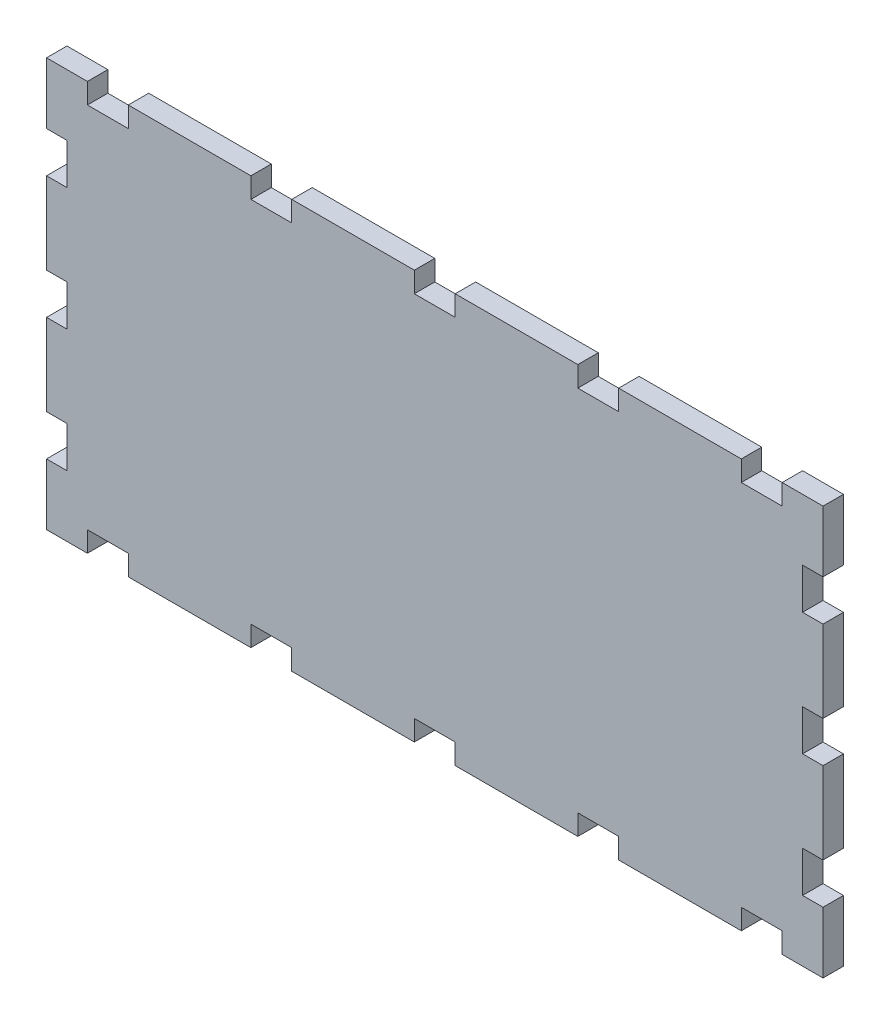
from build123d import *

# Parameters (mm, degrees)
BOSS_EXTRUDE1_DEPTH = 5


with BuildPart() as part:
    # Sketch1 → Boss-Extrude1 (new body)
    with BuildSketch(Plane.XY):
        Polygon((-85, 45), (-85, 50), (-95, 50), (-95, 35), (-90, 35), (-90, 25), (-95, 25), (-95, 5), (-90, 5), (-90, -5), (-95, -5), (-95, -25), (-90, -25), (-90, -35), (-95, -35), (-95, -50), (-85, -50), (-85, -45), (-75, -45), (-75, -50), (-45, -50), (-45, -45), (-35, -45), (-35, -50), (-5, -50), (-5, -45), (5, -45), (5, -50), (35, -50), (35, -45), (45, -45), (45, -50), (75, -50), (75, -45), (85, -45), (85, -50), (95, -50), (95, -35), (90, -35), (90, -25), (95, -25), (95, -5), (90, -5), (90, 5), (95, 5), (95, 25), (90, 25), (90, 35), (95, 35), (95, 50), (85, 50), (85, 45), (75, 45), (75, 50), (45, 50), (45, 45), (35, 45), (35, 50), (5, 50), (5, 45), (-5, 45), (-5, 50), (-35, 50), (-35, 45), (-45, 45), (-45, 50), (-75, 50), (-75, 45), align=None)
    extrude(amount=BOSS_EXTRUDE1_DEPTH)


solid = part.part
